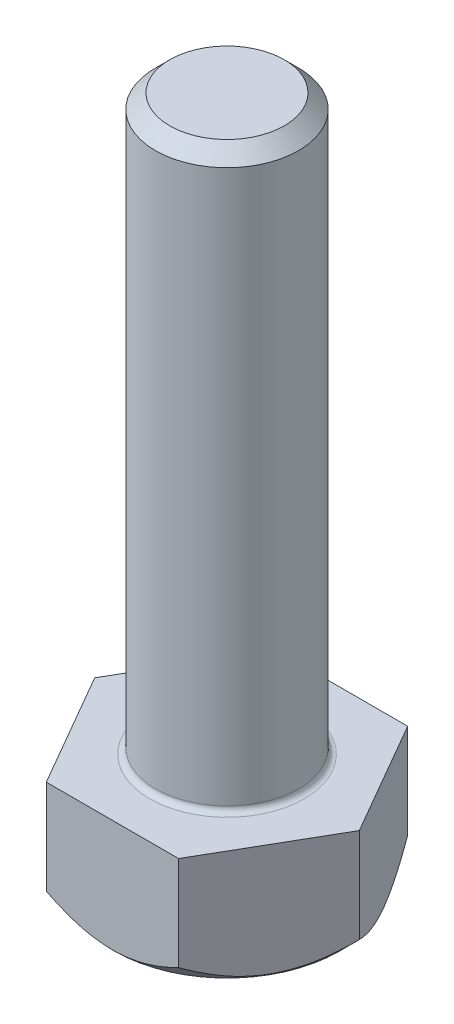
from build123d import *

# Parameters (mm, degrees)
BOSS_EXTRUDE1_DEPTH = 4
SKETCH2_R           = 2.5
BOSS_EXTRUDE2_DEPTH = 20
FILLET1_R           = 0.2
CHAMFER1_SIZE       = 0.5


with BuildPart() as part:
    # Sketch1 → Boss-Extrude1 (new body)
    with BuildSketch(Plane(origin=(0, 0, 0), x_dir=(1, 0, 0), z_dir=(0, 1, 0))):
        Polygon((4.618802154, 0), (2.309401077, 4), (-2.309401077, 4), (-4.618802154, 0), (-2.309401077, -4), (2.309401077, -4), align=None)
    extrude(amount=BOSS_EXTRUDE1_DEPTH)

    # Sketch2 → Boss-Extrude2 (add)
    with BuildSketch(Plane(origin=(0, 4, 0), x_dir=(1, 0, 0), z_dir=(0, 1, 0))):
        with Locations(Location((0, 0, 0), (0, 0, 270))):
            Circle(SKETCH2_R)
    extrude(amount=BOSS_EXTRUDE2_DEPTH)

    # Sketch3 → Cut-Revolve1 (revolve, cut)
    with BuildSketch(Plane.XY):
        Polygon((-4.618802154, 0.7), (-3.918802154, 0), (-4.618802154, 0), align=None)
    revolve(axis=Axis((0, -1000, 0), (0, 1, 0)), mode=Mode.SUBTRACT)

    # Fillet1
    fillet1_edges = [part.edges().sort_by_distance(p)[0] for p in [
        (0, 4, -2.5),
    ]]
    fillet(fillet1_edges, radius=FILLET1_R)

    # Chamfer1
    chamfer1_edges = [part.edges().sort_by_distance(p)[0] for p in [
        (0, 24, -2.5),
    ]]
    chamfer(chamfer1_edges, length=CHAMFER1_SIZE)


solid = part.part
